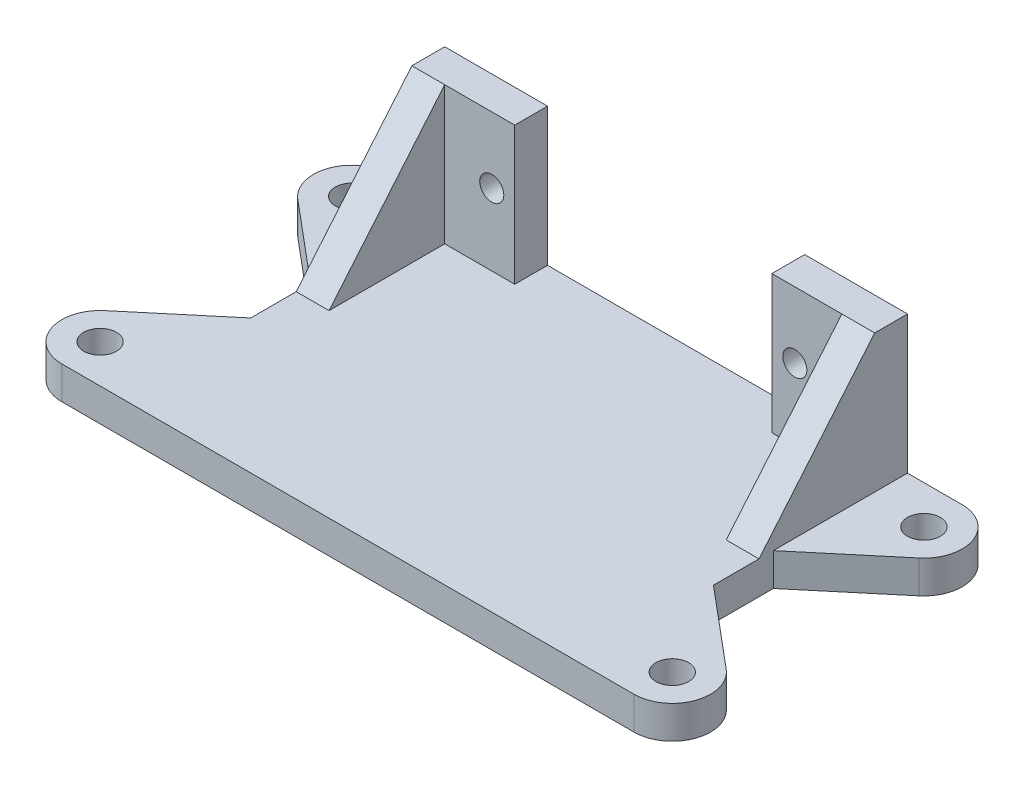
from build123d import *

# Parameters (mm, degrees)
BOSS_EXTRUDE1_DEPTH     = 3
SKETCH3_W               = 42.3
SKETCH3_H               = 30
BOSS_EXTRUDE2_DEPTH     = 3
SKETCH4_R               = 1.1
CUT_EXTRUDE1_DEPTH      = 38.67867434
BOSS_EXTRUDE3_DEPTH     = 3
BOSS_EXTRUDE4_START     = -3
SKETCH6_R               = 1.5
BOSS_EXTRUDE4_DEPTH     = 3
MIRROR3_START           = -3
MIRROR3_COPY_1_SKETCH_R = 1.5
MIRROR3_COPY_1_DEPTH    = 3


with BuildPart() as part:
    # Sketch2 → Boss-Extrude1 (new body)
    with BuildSketch(Plane.XY):
        Polygon((-11.75, 3), (11.75, 3), (11.75, 15.6), (21.15, 15.6), (21.15, 0), (-21.15, 0), (-21.15, 15.6), (-11.75, 15.6), align=None)
    extrude(amount=BOSS_EXTRUDE1_DEPTH)

    # Sketch3 → Boss-Extrude2 (add)
    with BuildSketch(Plane.XZ):
        with Locations((0, 15)):
            Rectangle(SKETCH3_W, SKETCH3_H)
    extrude(amount=-BOSS_EXTRUDE2_DEPTH)

    # Sketch4 → Cut-Extrude1 (cut, through all)
    with BuildSketch(Plane.XY.offset(3)):
        with Locations((13.85, 9.55)):
            Circle(SKETCH4_R)
        with Locations((-13.85, 9.55)):
            Circle(SKETCH4_R)
    extrude(amount=-CUT_EXTRUDE1_DEPTH, mode=Mode.SUBTRACT)

    # Sketch5 → Boss-Extrude3 (add)
    with BuildSketch(Plane(origin=(21.15, 0, 0), x_dir=(0, 0, -1), z_dir=(1, 0, 0))):
        Polygon((-3, 15.6), (-13.572655353, 3), (-3, 3), align=None)
    boss_extrude3 = extrude(amount=-BOSS_EXTRUDE3_DEPTH)

    # Mirror1: Boss-Extrude3 across plane
    add(boss_extrude3.mirror(Plane(origin=(0, 0, 0), x_dir=(0, 0, 1), z_dir=(1, 0, 0))))

    # Sketch6 → Boss-Extrude4 (add)
    with BuildSketch(Plane.XZ.offset(BOSS_EXTRUDE4_START)):
        with BuildLine():
            Line((-21.15, 30), (-26.15, 30))
            ThreePointArc((-26.15, 30), (-29.438924173, 27.697070502), (-28.399756634, 23.818844449))
            Line((-28.399756634, 23.818844449), (-21.15, 17.735576331))
            Line((-21.15, 17.735576331), (-21.15, 30))
        make_face()
        with Locations(Location((-26.15, 26.5, 0), (0, 0, 270))):
            Circle(SKETCH6_R, mode=Mode.SUBTRACT)
    boss_extrude4 = extrude(amount=BOSS_EXTRUDE4_DEPTH)

    # Mirror2: Boss-Extrude4 across plane
    add(boss_extrude4.mirror(Plane.XY.offset(15)))

    # Mirror3: Boss-Extrude4 across plane
    add(boss_extrude4.mirror(Plane(origin=(0, 0, 0), x_dir=(0, 0, 1), z_dir=(1, 0, 0))))

    # Mirror3 copy 1 sketch → Mirror3 copy 1 (add)
    with BuildSketch(Plane(origin=(0, 0, 30), x_dir=(-1, 0, 0), z_dir=(0, -1, 0)).offset(MIRROR3_START)):
        with BuildLine():
            Line((-21.15, 30), (-26.15, 30))
            ThreePointArc((-26.15, 30), (-29.438924173, 27.697070502), (-28.399756634, 23.818844449))
            Line((-28.399756634, 23.818844449), (-21.15, 17.735576331))
            Line((-21.15, 17.735576331), (-21.15, 30))
        make_face()
        with Locations(Location((-26.15, 26.5, 0), (0, 0, 270))):
            Circle(MIRROR3_COPY_1_SKETCH_R, mode=Mode.SUBTRACT)
    extrude(amount=MIRROR3_COPY_1_DEPTH)


solid = part.part
